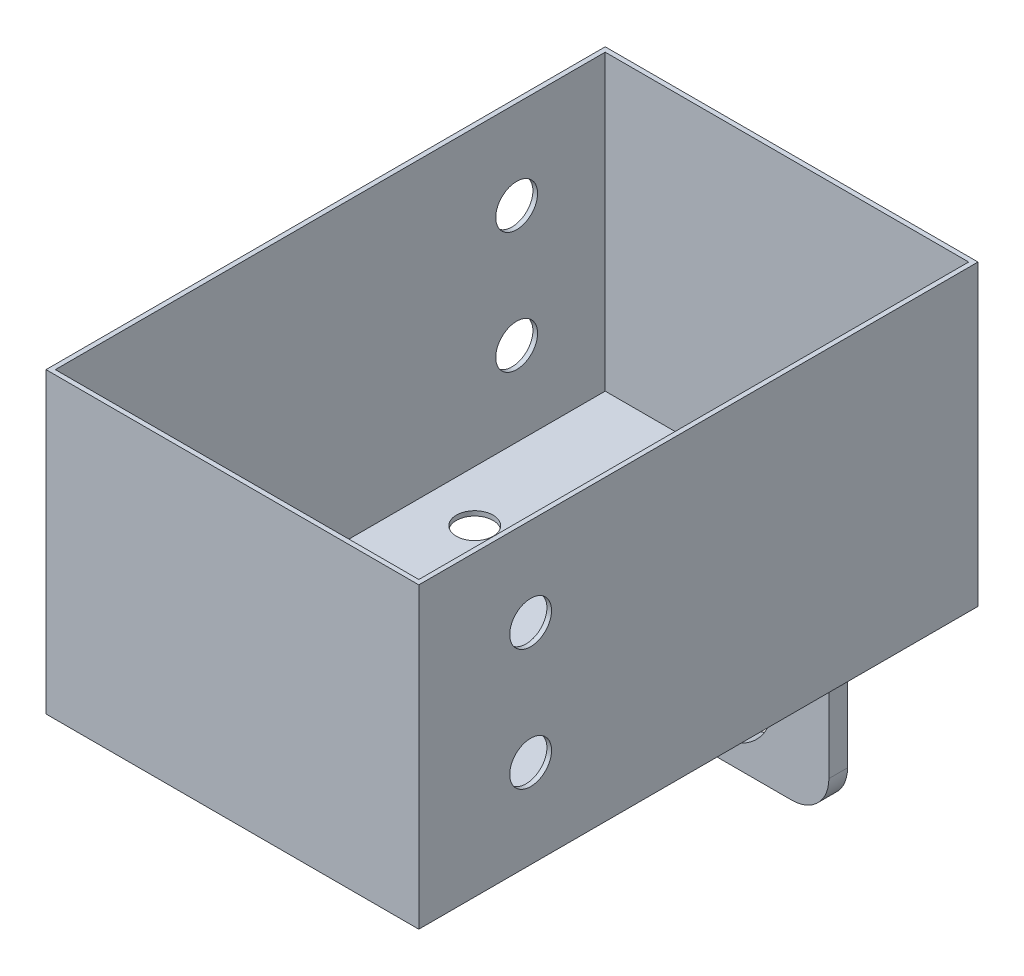
from build123d import *

# Parameters (mm, degrees)
SKETCH1_W           = 254
SKETCH1_H           = 381
BOSS_EXTRUDE1_DEPTH = 203.2
SHELL1_T            = -3.175
CUT_EXTRUDE1_REACH  = 378.957
SKETCH2_R           = 14.25
CUT_EXTRUDE2_REACH  = 378.957
SKETCH3_R           = 14.25
SKETCH4_W           = 152.4
SKETCH4_H           = 12.7
BOSS_EXTRUDE2_DEPTH = 127
CUT_EXTRUDE3_REACH  = 420.33
SKETCH5_R           = 38.1
FILLET1_R           = 25.4
FILLET2_R           = 25.4
CUT_EXTRUDE4_REACH  = 308.12
SKETCH6_R           = 6.35
SKETCH6_R_2         = 12.5


with BuildPart() as part:
    # Sketch1 → Boss-Extrude1 (new body)
    with BuildSketch(Plane(origin=(0, 0, 0), x_dir=(1, 0, 0), z_dir=(0, 1, 0))):
        Rectangle(SKETCH1_W, SKETCH1_H)
    extrude(amount=BOSS_EXTRUDE1_DEPTH)

    # Shell1
    shell1_openings = [part.faces().sort_by_distance(p)[0] for p in [
        (0, 203.2, 0),
    ]]
    offset(amount=SHELL1_T, openings=shell1_openings, kind=Kind.INTERSECTION)

    # Sketch2 → Cut-Extrude1 (cut, up to next)
    with BuildSketch(Plane(origin=(127, 0, 0), x_dir=(0, 0, -1), z_dir=(1, 0, 0)), mode=Mode.PRIVATE) as cut_extrude1_sk1:
        with Locations((-114.3, 142.875)):
            Circle(SKETCH2_R)
    cut_extrude1_tool1 = extrude(cut_extrude1_sk1.sketch, amount=-CUT_EXTRUDE1_REACH, mode=Mode.PRIVATE) & part.part
    # Sketch2 → Cut-Extrude1 (cut, up to next)
    with BuildSketch(Plane(origin=(127, 0, 0), x_dir=(0, 0, -1), z_dir=(1, 0, 0)), mode=Mode.PRIVATE) as cut_extrude1_sk2:
        with Locations((-114.3, 60.325)):
            Circle(SKETCH2_R)
    cut_extrude1_tool2 = extrude(cut_extrude1_sk2.sketch, amount=-CUT_EXTRUDE1_REACH, mode=Mode.PRIVATE) & part.part
    add(cut_extrude1_tool1.solids().sort_by_distance((127, 142.875, 114.3))[0], mode=Mode.SUBTRACT)
    add(cut_extrude1_tool2.solids().sort_by_distance((127, 60.325, 114.3))[0], mode=Mode.SUBTRACT)

    # Sketch3 → Cut-Extrude2 (cut, up to next)
    with BuildSketch(Plane.ZY.offset(127), mode=Mode.PRIVATE) as cut_extrude2_sk1:
        with Locations((-127, 142.875)):
            Circle(SKETCH3_R)
    cut_extrude2_tool1 = extrude(cut_extrude2_sk1.sketch, amount=-CUT_EXTRUDE2_REACH, mode=Mode.PRIVATE) & part.part
    # Sketch3 → Cut-Extrude2 (cut, up to next)
    with BuildSketch(Plane.ZY.offset(127), mode=Mode.PRIVATE) as cut_extrude2_sk2:
        with Locations((-127, 60.325)):
            Circle(SKETCH3_R)
    cut_extrude2_tool2 = extrude(cut_extrude2_sk2.sketch, amount=-CUT_EXTRUDE2_REACH, mode=Mode.PRIVATE) & part.part
    add(cut_extrude2_tool1.solids().sort_by_distance((-127, 142.875, -127))[0], mode=Mode.SUBTRACT)
    add(cut_extrude2_tool2.solids().sort_by_distance((-127, 60.325, -127))[0], mode=Mode.SUBTRACT)

    # Sketch4 → Boss-Extrude2 (add)
    with BuildSketch(Plane.XZ):
        with Locations((0, -146.05)):
            Rectangle(SKETCH4_W, SKETCH4_H)
    extrude(amount=BOSS_EXTRUDE2_DEPTH)

    # Sketch5 → Cut-Extrude3 (cut, up to next)
    with BuildSketch(Plane(origin=(0, 0, -152.4), x_dir=(-1, 0, 0), z_dir=(0, 0, -1)), mode=Mode.PRIVATE) as cut_extrude3_sk1:
        with Locations((0, -76.2)):
            Circle(SKETCH5_R)
    cut_extrude3_tool1 = extrude(cut_extrude3_sk1.sketch, amount=-CUT_EXTRUDE3_REACH, mode=Mode.PRIVATE) & part.part
    add(cut_extrude3_tool1.solids().sort_by_distance((0, -76.2, -152.4))[0], mode=Mode.SUBTRACT)

    # Fillet1
    fillet1_edges = [part.edges().sort_by_distance(p)[0] for p in [
        (-76.2, -127, -146.05),
        (76.2, -127, -146.05),
    ]]
    fillet(fillet1_edges, radius=FILLET1_R)

    # Fillet2
    fillet2_edges = [part.edges().sort_by_distance(p)[0] for p in [
        (0, 0, -139.7),
    ]]
    fillet(fillet2_edges, radius=FILLET2_R)

    # Sketch6 → Cut-Extrude4 (cut, up to next)
    with BuildSketch(Plane.XZ, mode=Mode.PRIVATE) as cut_extrude4_sk1:
        with Locations((63.5, 165.1)):
            Circle(SKETCH6_R)
    cut_extrude4_tool1 = extrude(cut_extrude4_sk1.sketch, amount=-CUT_EXTRUDE4_REACH, mode=Mode.PRIVATE) & part.part
    # Sketch6 → Cut-Extrude4 (cut, up to next)
    with BuildSketch(Plane.XZ, mode=Mode.PRIVATE) as cut_extrude4_sk2:
        with Locations((-88.9, -63.5)):
            Circle(SKETCH6_R_2)
    cut_extrude4_tool2 = extrude(cut_extrude4_sk2.sketch, amount=-CUT_EXTRUDE4_REACH, mode=Mode.PRIVATE) & part.part
    # Sketch6 → Cut-Extrude4 (cut, up to next)
    with BuildSketch(Plane.XZ, mode=Mode.PRIVATE) as cut_extrude4_sk3:
        with Locations((101.6, -160.02)):
            Circle(SKETCH6_R_2)
    cut_extrude4_tool3 = extrude(cut_extrude4_sk3.sketch, amount=-CUT_EXTRUDE4_REACH, mode=Mode.PRIVATE) & part.part
    add(cut_extrude4_tool1.solids().sort_by_distance((63.5, 0, 165.1))[0], mode=Mode.SUBTRACT)
    add(cut_extrude4_tool2.solids().sort_by_distance((-88.9, 0, -63.5))[0], mode=Mode.SUBTRACT)
    add(cut_extrude4_tool3.solids().sort_by_distance((101.6, 0, -160.02))[0], mode=Mode.SUBTRACT)


solid = part.part
